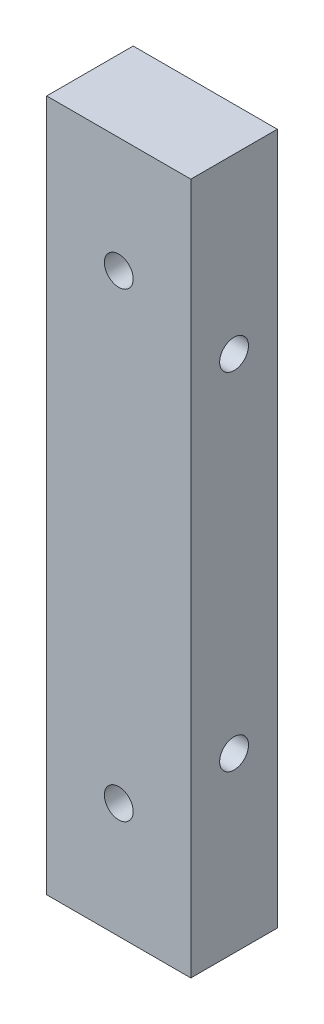
from build123d import *

# Parameters (mm, degrees)
SKETCH1_W           = 25
SKETCH1_H           = 15
BOSS_EXTRUDE1_DEPTH = 60
M6_TAPPED_HOLE1_D   = 5
M6_TAPPED_HOLE2_D   = 5


with BuildPart() as part:
    # Sketch1 → Boss-Extrude1 (new, symmetric)
    with BuildSketch(Plane(origin=(0, 0, 0), x_dir=(1, 0, 0), z_dir=(0, 1, 0))):
        Rectangle(SKETCH1_W, SKETCH1_H)
    extrude(amount=BOSS_EXTRUDE1_DEPTH, both=True)

    # M6 Tapped Hole1 (through all)
    with Locations(Plane.ZY.offset(12.5)):
        with Locations((0, 30), (0, -30)):
            Hole(M6_TAPPED_HOLE1_D / 2)

    # M6 Tapped Hole2 (through all)
    with Locations(Plane.XY.offset(7.5)):
        with Locations((0, 40), (0, -40)):
            Hole(M6_TAPPED_HOLE2_D / 2)


solid = part.part
